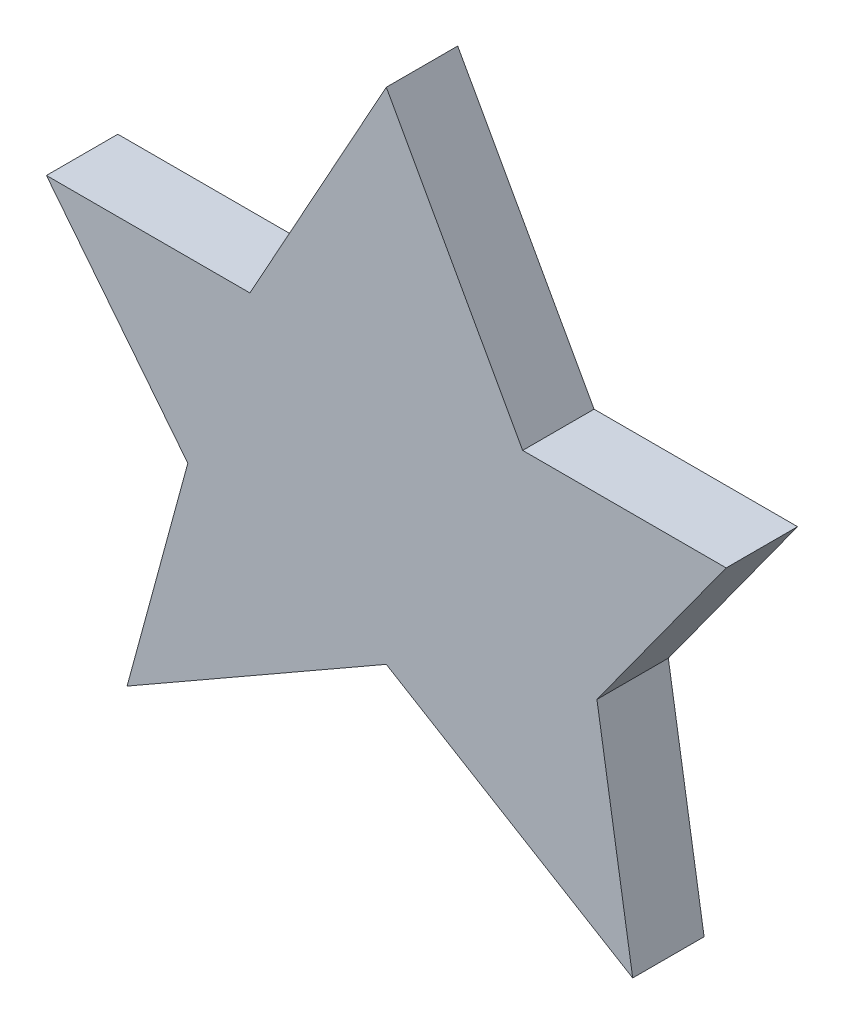
from build123d import *

# Parameters (mm, degrees)
EXTRUDE_1_DEPTH = 10


with BuildPart() as part:
    # 草图1 → 凸台-拉伸1 (new body)
    with BuildSketch(Plane.XY):
        Polygon((0, 50), (19.1, 15.5), (47.6, 15.5), (29.5, -9.5), (34.508785337, -40.786760584), (0, -20), (-36.3, -40.786760584), (-27.797870916, -9.5), (-47.6, 15.5), (-19.1, 15.5), align=None)
    extrude(amount=EXTRUDE_1_DEPTH)


solid = part.part
